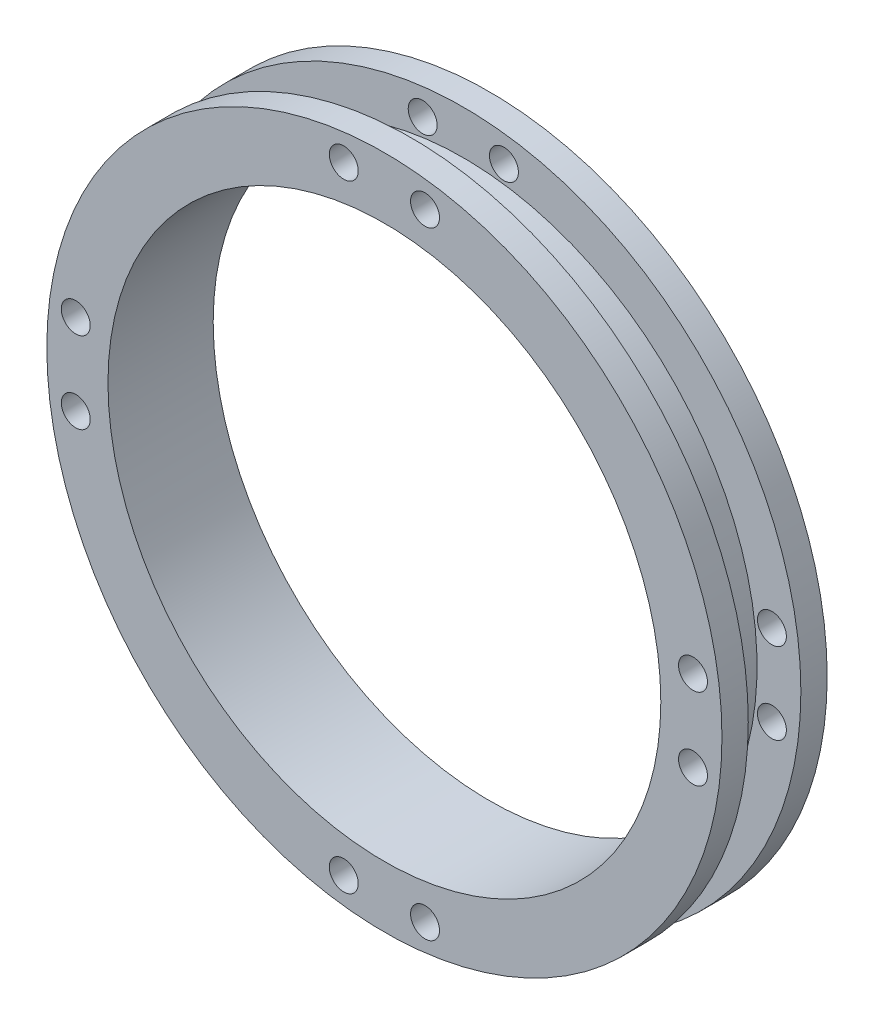
from build123d import *
from build123d.topology import SkipClean

# Parameters (mm, degrees)
SKETCH1_R           = 33.5
SKETCH1_R_2         = 31.5
BOSS_EXTRUDE1_DEPTH = 9
BOSS_EXTRUDE2_START = -3
SKETCH1_2_R         = 33.5
BOSS_EXTRUDE2_DEPTH = 3
SKETCH2_R           = 38.5
SKETCH2_R_2         = 33.5
BOSS_EXTRUDE3_DEPTH = 3
BOSS_EXTRUDE4_START = -3
SKETCH3_R           = 38.5
SKETCH3_R_2         = 33.5
BOSS_EXTRUDE4_DEPTH = 3
SKETCH10_R          = 2
CUT_EXTRUDE1_DEPTH  = 10
M4_TAPPED_HOLE1_D   = 3.3
CIRPATTERN1_COUNT   = 4
SKETCH14_R          = 31.525
CUT_EXTRUDE2_DEPTH  = 56.186048962
SKETCH15_R          = 31.525
CUT_EXTRUDE3_DEPTH  = 10


with BuildPart() as part:
    # Sketch1 → Boss-Extrude1 (new body)
    with BuildSketch(Plane.XY):
        Circle(SKETCH1_R)
        Circle(SKETCH1_R_2, mode=Mode.SUBTRACT)
    extrude(amount=BOSS_EXTRUDE1_DEPTH)

    # Sketch1<2> → Boss-Extrude2 (add)
    with BuildSketch(Plane.XY.offset(BOSS_EXTRUDE2_START)):
        Circle(SKETCH1_2_R)
    extrude(amount=BOSS_EXTRUDE2_DEPTH)

    # Sketch2 → Boss-Extrude3 (add)
    with BuildSketch(Plane(origin=(0, 0, -3), x_dir=(-1, 0, 0), z_dir=(0, 0, -1))):
        Circle(SKETCH2_R)
        Circle(SKETCH2_R_2, mode=Mode.SUBTRACT)
    extrude(amount=-BOSS_EXTRUDE3_DEPTH)

    # Sketch3 → Boss-Extrude4 (add)
    with BuildSketch(Plane.XY.offset(9).offset(BOSS_EXTRUDE4_START)):
        Circle(SKETCH3_R)
        Circle(SKETCH3_R_2, mode=Mode.SUBTRACT)
    extrude(amount=BOSS_EXTRUDE4_DEPTH)

    # Sketch10 → Cut-Extrude1 (cut)
    with BuildSketch(Plane(origin=(0, 0, -3), x_dir=(-1, 0, 0), z_dir=(0, 0, -1))):
        with Locations((0, 11)):
            Circle(SKETCH10_R)
        with Locations((11, 0)):
            Circle(SKETCH10_R)
        with Locations((0, -11)):
            Circle(SKETCH10_R)
        with Locations((-11, 0)):
            Circle(SKETCH10_R)
    extrude(amount=-CUT_EXTRUDE1_DEPTH, mode=Mode.SUBTRACT)

    # M4 Tapped Hole1 (through all)
    with Locations(Plane(origin=(0, 0, -3), x_dir=(-1, 0, 0), z_dir=(0, 0, -1))):
        with Locations((-4.633679824, 35.196292579), (4.633679824, 35.196292579)):
            m4_tapped_hole1 = Hole(M4_TAPPED_HOLE1_D / 2)

    # CirPattern1: M4 Tapped Hole1 ×4 about axis
    cirpattern1_axis = Axis((0, 0, 9), (0, 0, -1))
    for i in range(1, CIRPATTERN1_COUNT):
        add(m4_tapped_hole1.rotate(cirpattern1_axis, i * 360 / CIRPATTERN1_COUNT), mode=Mode.SUBTRACT)

    # Sketch14 → Cut-Extrude2 (cut, through all)
    with BuildSketch(Plane.XY):
        Circle(SKETCH14_R)
    extrude(amount=CUT_EXTRUDE2_DEPTH, mode=Mode.SUBTRACT)

    # Sketch15 → Cut-Extrude3 (cut)
    with SkipClean():  # the faces are left unmerged after this step: merging them gives an invalid solid
        with BuildSketch(Plane(origin=(0, 0, -3), x_dir=(-1, 0, 0), z_dir=(0, 0, -1))):
            Circle(SKETCH15_R)
        extrude(amount=-CUT_EXTRUDE3_DEPTH, mode=Mode.SUBTRACT)


solid = part.part
